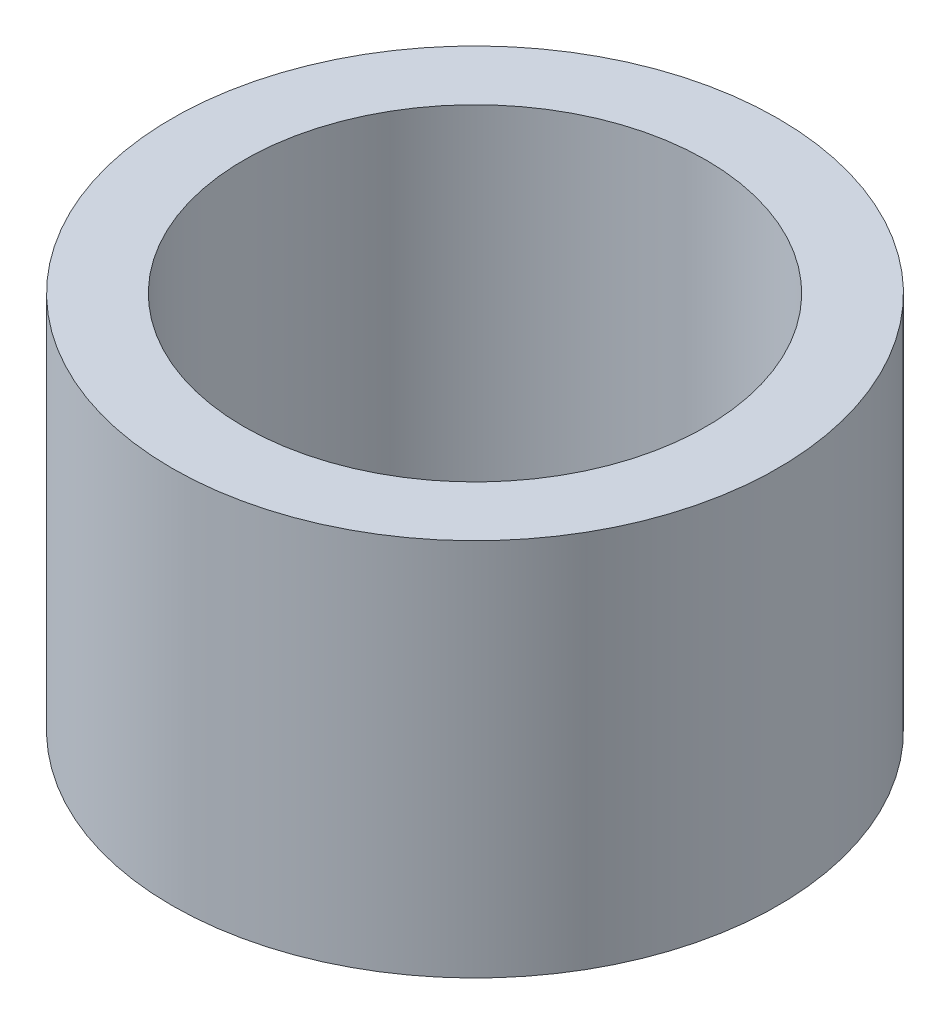
from build123d import *

# Parameters (mm, degrees)
SKETCH1_R           = 4
SKETCH1_R_2         = 3.05
BOSS_EXTRUDE1_DEPTH = 5


with BuildPart() as part:
    # Sketch1 → Boss-Extrude1 (new body)
    with BuildSketch(Plane(origin=(0, 0, 0), x_dir=(1, 0, 0), z_dir=(0, 1, 0))):
        with Locations(Location((0, 0, 0), (0, 0, 270))):
            Circle(SKETCH1_R)
        with Locations(Location((0, 0, 0), (0, 0, 270))):
            Circle(SKETCH1_R_2, mode=Mode.SUBTRACT)
    extrude(amount=BOSS_EXTRUDE1_DEPTH)


solid = part.part
